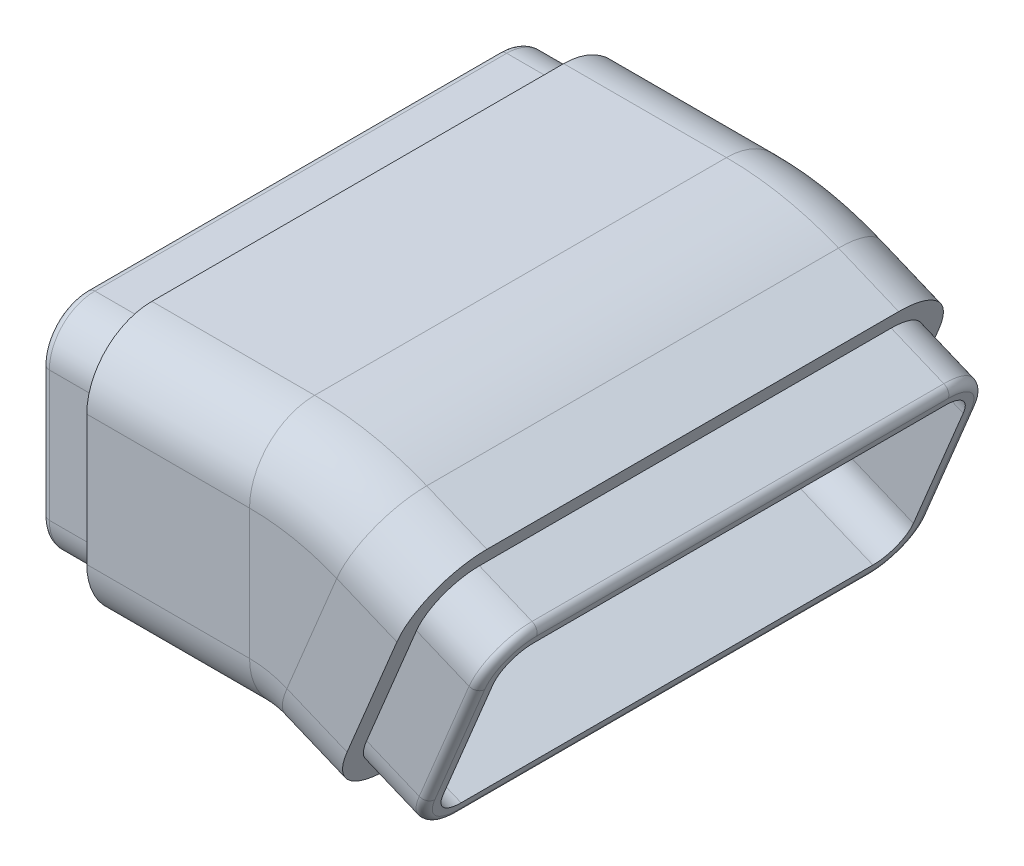
from build123d import *

# Parameters (mm, degrees)
BOSS_EXTRUDE1_DEPTH = 4
SKETCH5_OUTSIDE_W   = 44.302
SKETCH5_OUTSIDE_H   = 28.685
CUT_EXTRUDE1_DEPTH  = 4
FILLET1_R           = 0.5
BOSS_EXTRUDE2_DEPTH = 4
SKETCH9_OUTSIDE_W   = 44.726
SKETCH9_OUTSIDE_H   = 38.999
CUT_EXTRUDE2_DEPTH  = 4
FILLET2_R           = 0.5


with BuildPart() as part:
    # Sweep1: sweep along a path in Sketch2path
    with BuildLine(Plane.XY) as sweep1_path:
        Line((17.522352454, -2.291938404), (13.826834324, -0.761204675))
        ThreePointArc((13.826834324, -0.761204675), (11.95090322, -0.192147196), (10, 0))
        Line((10, 0), (0, 0))
    # Sketch3 → Sweep1 (sweep)
    with BuildSketch(Plane(origin=(0, 0, 0), x_dir=(0, 0, -1), z_dir=(1, 0, 0))):
        with BuildLine():
            Line((-16.65, -4), (-16.65, 4))
            ThreePointArc((-16.65, 4), (-15.478427125, 6.828427125), (-12.65, 8))
            Line((-12.65, 8), (12.65, 8))
            ThreePointArc((12.65, 8), (15.478427125, 6.828427125), (16.65, 4))
            Line((16.65, 4), (16.65, -4))
            ThreePointArc((16.65, -4), (15.478427125, -6.828427125), (12.65, -8))
            Line((12.65, -8), (-12.65, -8))
            ThreePointArc((-12.65, -8), (-15.478427125, -6.828427125), (-16.65, -4))
        make_face()
        with BuildLine():
            Line((-15.65, -4), (-15.65, 4))
            ThreePointArc((-15.65, 4), (-14.771320344, 6.121320344), (-12.65, 7))
            Line((-12.65, 7), (12.65, 7))
            ThreePointArc((12.65, 7), (14.771320344, 6.121320344), (15.65, 4))
            Line((15.65, 4), (15.65, -4))
            ThreePointArc((15.65, -4), (14.771320344, -6.121320344), (12.65, -7))
            Line((12.65, -7), (-12.65, -7))
            ThreePointArc((-12.65, -7), (-14.771320344, -6.121320344), (-15.65, -4))
        make_face(mode=Mode.SUBTRACT)
    sweep(path=sweep1_path.line)

    # Sketch4 → Boss-Extrude1 (add, symmetric)
    with BuildSketch(Plane.ZY):
        with BuildLine():
            Line((15.65, 4), (15.65, -4))
            ThreePointArc((15.65, -4), (14.771320344, -6.121320344), (12.65, -7))
            Line((12.65, -7), (-12.65, -7))
            ThreePointArc((-12.65, -7), (-14.771320344, -6.121320344), (-15.65, -4))
            Line((-15.65, -4), (-15.65, 4))
            ThreePointArc((-15.65, 4), (-14.771320344, 6.121320344), (-12.65, 7))
            Line((-12.65, 7), (12.65, 7))
            ThreePointArc((12.65, 7), (14.771320344, 6.121320344), (15.65, 4))
        make_face()
        with BuildLine():
            Line((14.45, 4), (14.45, -4))
            ThreePointArc((14.45, -4), (13.922792206, -5.272792206), (12.65, -5.8))
            Line((12.65, -5.8), (-12.65, -5.8))
            ThreePointArc((-12.65, -5.8), (-13.922792206, -5.272792206), (-14.45, -4))
            Line((-14.45, -4), (-14.45, 4))
            ThreePointArc((-14.45, 4), (-13.922792206, 5.272792206), (-12.65, 5.8))
            Line((-12.65, 5.8), (12.65, 5.8))
            ThreePointArc((12.65, 5.8), (13.922792206, 5.272792206), (14.45, 4))
        make_face(mode=Mode.SUBTRACT)
    extrude(amount=BOSS_EXTRUDE1_DEPTH, both=True)

    # Sketch5 outside → Cut-Extrude1 (cut)
    with BuildSketch(Plane.ZY.offset(4)):
        with Locations((0, -0.8415)):
            Rectangle(SKETCH5_OUTSIDE_W, SKETCH5_OUTSIDE_H)
        with BuildLine():
            Line((12.65, 6.8), (-12.65, 6.8))
            ThreePointArc((-12.65, 6.8), (-14.629898987, 5.979898987), (-15.45, 4))
            Line((-15.45, 4), (-15.45, -4))
            ThreePointArc((-15.45, -4), (-14.629898987, -5.979898987), (-12.65, -6.8))
            Line((-12.65, -6.8), (12.65, -6.8))
            ThreePointArc((12.65, -6.8), (14.629898987, -5.979898987), (15.45, -4))
            Line((15.45, -4), (15.45, 4))
            ThreePointArc((15.45, 4), (14.629898987, 5.979898987), (12.65, 6.8))
        make_face(mode=Mode.SUBTRACT)
    extrude(amount=-CUT_EXTRUDE1_DEPTH, mode=Mode.SUBTRACT)

    # Fillet1
    fillet1_edges = [part.edges().sort_by_distance(p)[0] for p in [
        (4, 5.272792206, 13.922792206),
        (4, 5.8, 0),
        (4, 5.272792206, -13.922792206),
        (4, 0, -14.45),
        (4, -5.272792206, -13.922792206),
        (4, -5.8, 0),
        (4, -5.272792206, 13.922792206),
        (4, 0, 14.45),
        (4, 6.121320344, 14.771320344),
        (4, 7, 0),
        (4, 6.121320344, -14.771320344),
        (4, 0, -15.65),
        (4, -6.121320344, -14.771320344),
        (4, -7, 0),
        (4, -6.121320344, 14.771320344),
        (4, 0, 15.65),
        (-4, 5.979898987, 14.629898987),
        (-4, 0, 15.45),
        (-4, -5.979898987, 14.629898987),
        (-4, -6.8, 0),
        (-4, -5.979898987, -14.629898987),
        (-4, 0, -15.45),
        (-4, 5.979898987, -14.629898987),
        (-4, 6.8, 0),
    ]]
    fillet(fillet1_edges, radius=FILLET1_R)

    # Sketch6 → Boss-Extrude2 (add, symmetric)
    with BuildSketch(Plane(origin=(15.766585942, -6.530733729, 0), x_dir=(0, 0, -1), z_dir=(0.9238795325112864, -0.38268343236509084, 0))):
        with BuildLine():
            Line((-15.65, 8.588038999), (-15.65, 0.588038999))
            ThreePointArc((-15.65, 0.588038999), (-14.771320344, -1.533281345), (-12.65, -2.411961001))
            Line((-12.65, -2.411961001), (12.65, -2.411961001))
            ThreePointArc((12.65, -2.411961001), (14.771320344, -1.533281345), (15.65, 0.588038999))
            Line((15.65, 0.588038999), (15.65, 8.588038999))
            ThreePointArc((15.65, 8.588038999), (14.771320344, 10.709359342), (12.65, 11.588038999))
            Line((12.65, 11.588038999), (-12.65, 11.588038999))
            ThreePointArc((-12.65, 11.588038999), (-14.771320344, 10.709359342), (-15.65, 8.588038999))
        make_face()
        with BuildLine():
            Line((-14.45, 8.588038999), (-14.45, 0.588038999))
            ThreePointArc((-14.45, 0.588038999), (-13.922792206, -0.684753208), (-12.65, -1.211961001))
            Line((-12.65, -1.211961001), (12.65, -1.211961001))
            ThreePointArc((12.65, -1.211961001), (13.922792206, -0.684753208), (14.45, 0.588038999))
            Line((14.45, 0.588038999), (14.45, 8.588038999))
            ThreePointArc((14.45, 8.588038999), (13.922792206, 9.860831205), (12.65, 10.388038999))
            Line((12.65, 10.388038999), (-12.65, 10.388038999))
            ThreePointArc((-12.65, 10.388038999), (-13.922792206, 9.860831205), (-14.45, 8.588038999))
        make_face(mode=Mode.SUBTRACT)
    extrude(amount=BOSS_EXTRUDE2_DEPTH, both=True)

    # Sketch9 outside → Cut-Extrude2 (cut)
    with BuildSketch(Plane(origin=(19.462104072, -8.061467459, 0), x_dir=(0, 0, -1), z_dir=(0.9238795325112863, -0.3826834323650909, 0))):
        with Locations((0, 2.7495)):
            Rectangle(SKETCH9_OUTSIDE_W, SKETCH9_OUTSIDE_H)
        with BuildLine():
            Line((-12.65, -2.211961001), (12.65, -2.211961001))
            ThreePointArc((12.65, -2.211961001), (14.629898987, -1.391859989), (15.45, 0.588038999))
            Line((15.45, 0.588038999), (15.45, 8.588038999))
            ThreePointArc((15.45, 8.588038999), (14.629898987, 10.567937986), (12.65, 11.388038999))
            Line((12.65, 11.388038999), (-12.65, 11.388038999))
            ThreePointArc((-12.65, 11.388038999), (-14.629898987, 10.567937986), (-15.45, 8.588038999))
            Line((-15.45, 8.588038999), (-15.45, 0.588038999))
            ThreePointArc((-15.45, 0.588038999), (-14.629898987, -1.391859989), (-12.65, -2.211961001))
        make_face(mode=Mode.SUBTRACT)
    extrude(amount=-CUT_EXTRUDE2_DEPTH, mode=Mode.SUBTRACT)

    # Fillet2
    fillet2_edges = [part.edges().sort_by_distance(p)[0] for p in [
        (15.844644543, 4.110220124, 13.922792206),
        (13.826834324, -0.761204675, 14.45),
        (11.809024104, -5.632629473, 13.922792206),
        (11.607270416, -6.119705963, 0),
        (11.809024104, -5.632629473, -13.922792206),
        (13.826834324, -0.761204675, -14.45),
        (15.844644543, 4.110220124, -13.922792206),
        (16.046398231, 4.597296614, 0),
        (18.615623244, -10.105052955, 0),
        (18.929462314, -9.347378415, -14.629898987),
        (21.217870584, -3.822672134, -15.45),
        (23.506278853, 1.702034147, -14.629898987),
        (23.820117924, 2.459708687, 0),
        (23.506278853, 1.702034147, 14.629898987),
        (21.217870584, -3.822672134, 15.45),
        (18.929462314, -9.347378415, 14.629898987),
    ]]
    fillet(fillet2_edges, radius=FILLET2_R)


solid = part.part
